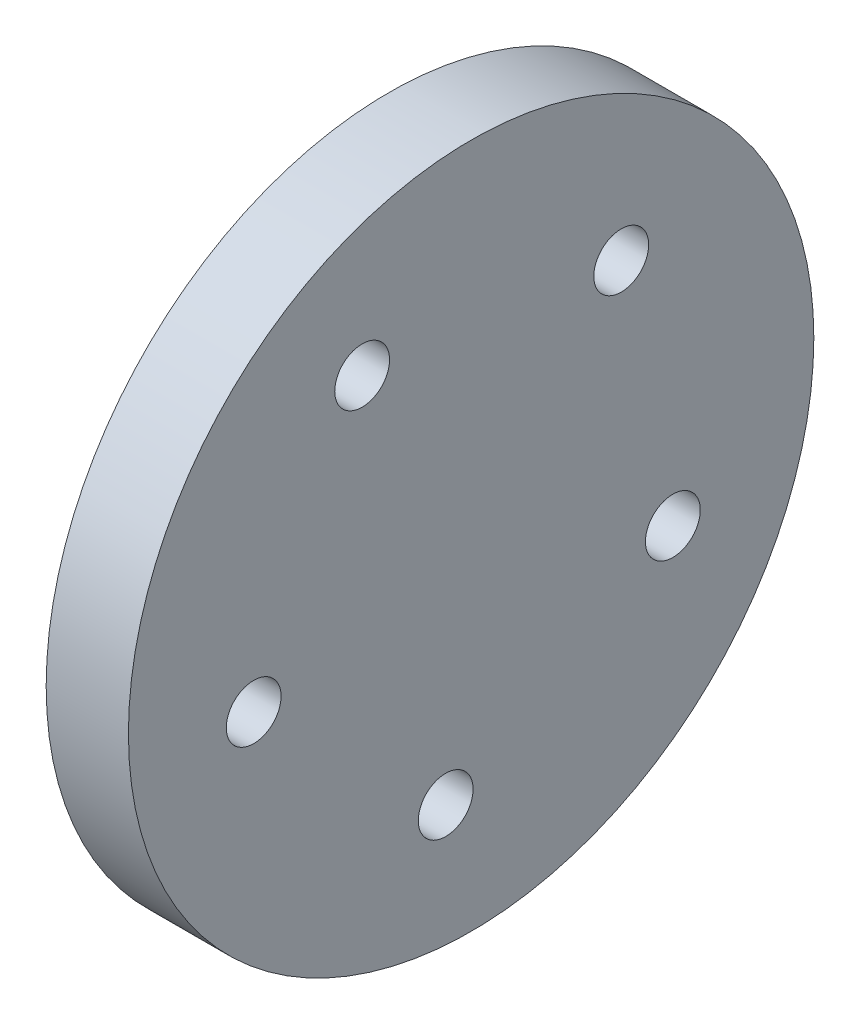
from build123d import *

# Parameters (mm, degrees)
SKETCH1_R          = 23.8125
WHEEL_BODY_DEPTH   = 5.715
SKETCH2_R          = 2.8
C24T_SPLINE_DEPTH  = 3.4544
SKETCH3_R          = 1.905
CUT_EXTRUDE2_DEPTH = 35.157452152


with BuildPart() as part:
    # Sketch1 → Wheel Body (new body)
    with BuildSketch(Plane(origin=(0, 0, 0), x_dir=(0, 0, -1), z_dir=(1, 0, 0))):
        Circle(SKETCH1_R)
    extrude(amount=WHEEL_BODY_DEPTH)

    # Sketch2 → C24T Spline (cut)
    with BuildSketch(Plane(origin=(0, 0, 0), x_dir=(0, 0, -1), z_dir=(1, 0, 0))):
        Circle(SKETCH2_R)
    extrude(amount=C24T_SPLINE_DEPTH, mode=Mode.SUBTRACT)

    # Sketch3 → Cut-Extrude2 (cut, through all)
    with BuildSketch(Plane.ZY):
        with Locations((-10.429406727, 11.349688472)):
            Circle(SKETCH3_R)
        with Locations((7.571331259, 13.426201847)):
            Circle(SKETCH3_R)
        with Locations((15.108746785, -3.05183939)):
            Circle(SKETCH3_R)
        with Locations((1.766387782, -15.312342319)):
            Circle(SKETCH3_R)
        with Locations((-14.017059099, -6.41170861)):
            Circle(SKETCH3_R)
    extrude(amount=-CUT_EXTRUDE2_DEPTH, mode=Mode.SUBTRACT)


solid = part.part
